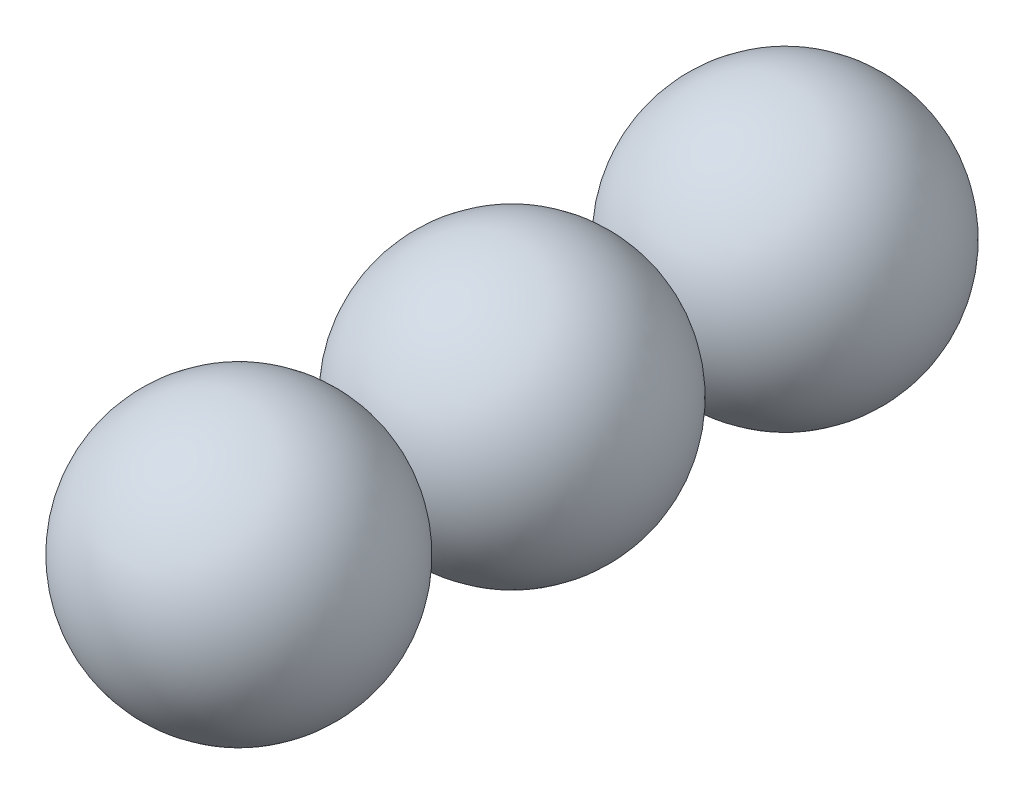
from build123d import *

# Parameters (mm, degrees)
PATTERN_LINEAR_1_COUNT = 3
PATTERN_LINEAR_1_PITCH = 60


with BuildPart() as part:
    # 草圖1 → 旋轉1 (revolve)
    with BuildSketch(Plane.XY):
        with BuildLine():
            Line((0, 30), (0, -30))
            ThreePointArc((0, -30), (30, 0), (0, 30))
        make_face()
    revolve(axis=Axis((0, 30, 0), (0, -1, 0)))


with BuildPart() as pattern_linear_1_1:
    # 直線複製排列1: pattern copy
    add(part.part.moved(Location(Vector(0, 0, 1) * (1 * PATTERN_LINEAR_1_PITCH))))


with BuildPart() as pattern_linear_1_2:
    # 直線複製排列1: pattern copy
    add(part.part.moved(Location(Vector(0, 0, 1) * (2 * PATTERN_LINEAR_1_PITCH))))


solid = Compound([part.part, pattern_linear_1_1.part, pattern_linear_1_2.part])
